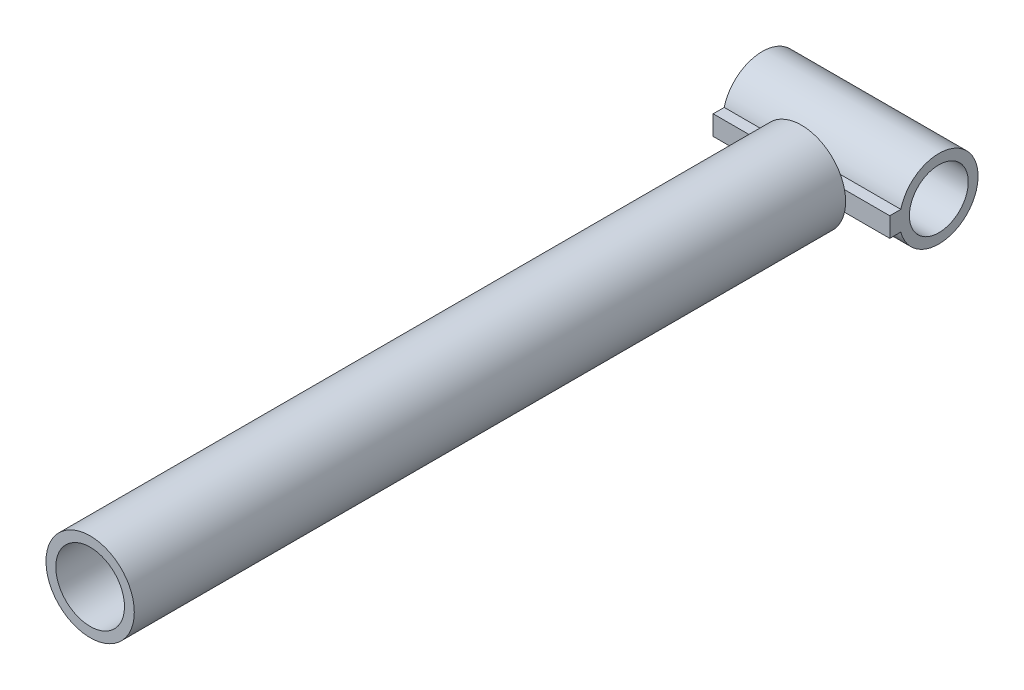
from build123d import *

# Parameters (mm, degrees)
IZIM1_R                     = 45
Y_KSEKLIK_EKSTR_ZYON1_DEPTH = 725
IZIM2_R                     = 35
KES_EKSTR_ZYON1_DEPTH       = 600
IZIM3_R                     = 30
Y_KSEKLIK_EKSTR_ZYON2_DEPTH = 90


with BuildPart() as part:
    # Çizim1 → Yükseklik-Ekstrüzyon1 (new body)
    with BuildSketch(Plane.XY):
        Circle(IZIM1_R)
    extrude(amount=Y_KSEKLIK_EKSTR_ZYON1_DEPTH)

    # Çizim2 → Kes-Ekstrüzyon1 (cut)
    with BuildSketch(Plane.XY.offset(725)):
        Circle(IZIM2_R)
    extrude(amount=-KES_EKSTR_ZYON1_DEPTH, mode=Mode.SUBTRACT)

    # Çizim3 → Yükseklik-Ekstrüzyon2 (add, symmetric)
    with BuildSketch(Plane(origin=(0, 0, 0), x_dir=(0, 0, -1), z_dir=(1, 0, 0))):
        with BuildLine():
            Line((0, 10), (11.270166538, 10))
            ThreePointArc((11.270166538, 10), (90, 0), (11.270166538, -10))
            Line((11.270166538, -10), (0, -10))
            Line((0, -10), (0, 10))
        make_face()
        with Locations(Location((50, 0, 0), (0, 0, 180))):
            Circle(IZIM3_R, mode=Mode.SUBTRACT)
    extrude(amount=Y_KSEKLIK_EKSTR_ZYON2_DEPTH, both=True)


solid = part.part
